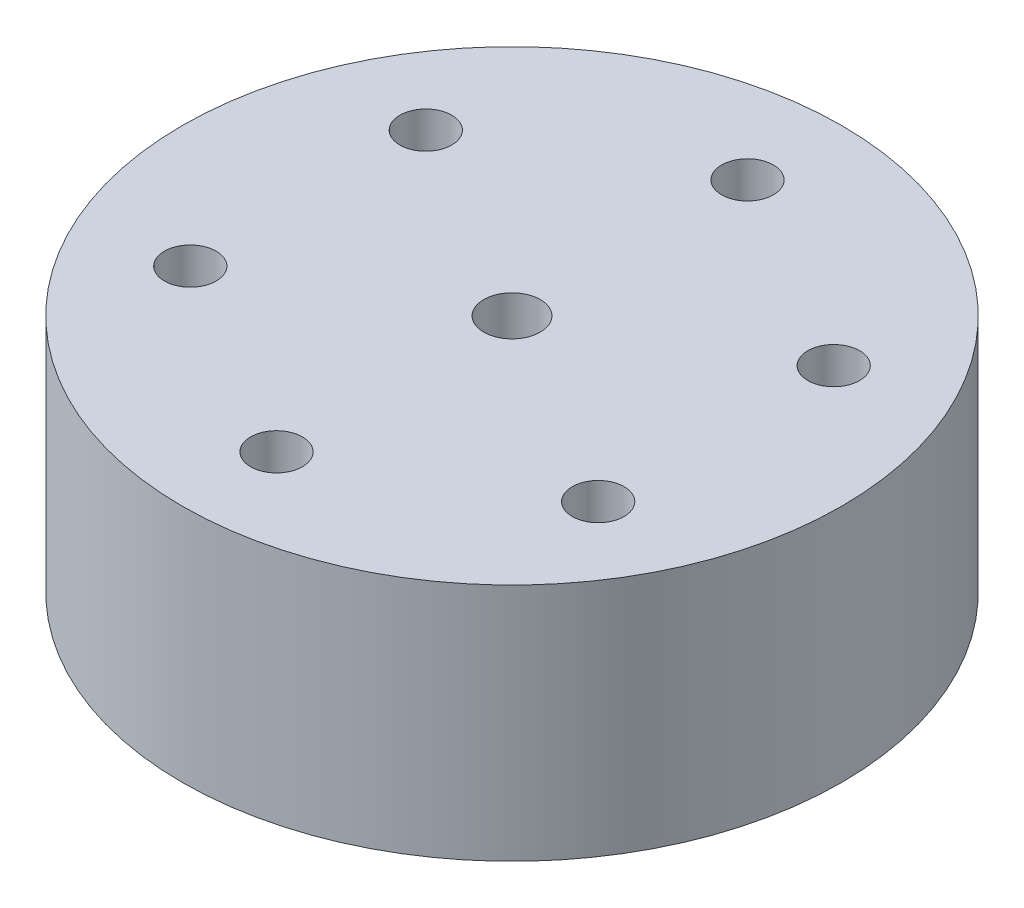
from build123d import *

# Parameters (mm, degrees)
SKETCH2_R           = 35
BOSS_EXTRUDE1_DEPTH = 25.4
CUT_EXTRUDE1_DEPTH  = 56.634162167
SKETCH5_R           = 2.75
CUT_EXTRUDE3_DEPTH  = 56.634162167


with BuildPart() as part:
    # Sketch2 → Boss-Extrude1 (new body)
    with BuildSketch(Plane(origin=(0, 0, 0), x_dir=(1, 0, 0), z_dir=(0, 1, 0))):
        with Locations(Location((0, 0, 0), (0, 0, 270))):
            Circle(SKETCH2_R)
    extrude(amount=BOSS_EXTRUDE1_DEPTH)

    # Sketch3 → Cut-Extrude1 (cut, through all)
    with BuildSketch(Plane(origin=(0, 25.4, 0), x_dir=(1, 0, 0), z_dir=(0, 1, 0))):
        with BuildLine():
            ThreePointArc((-1.658312395, 2.5), (0, -3), (1.658312395, 2.5))
            ThreePointArc((1.658312395, 2.5), (0, 3), (-1.658312395, 2.5))
        make_face()
    extrude(amount=-CUT_EXTRUDE1_DEPTH, mode=Mode.SUBTRACT)

    # Sketch5 → Cut-Extrude3 (cut, through all)
    with BuildSketch(Plane(origin=(0, 25.4, 0), x_dir=(1, 0, 0), z_dir=(0, 1, 0))):
        with Locations(Location((0, 25, 0), (0, 0, 270))):
            Circle(SKETCH5_R)
        with Locations(Location((21.650635095, 12.5, 0), (0, 0, 270))):
            Circle(SKETCH5_R)
        with Locations(Location((21.650635095, -12.5, 0), (0, 0, 270))):
            Circle(SKETCH5_R)
        with Locations(Location((0, -25, 0), (0, 0, 270))):
            Circle(SKETCH5_R)
        with Locations(Location((-21.650635095, -12.5, 0), (0, 0, 270))):
            Circle(SKETCH5_R)
        with Locations(Location((-21.650635095, 12.5, 0), (0, 0, 270))):
            Circle(SKETCH5_R)
    extrude(amount=-CUT_EXTRUDE3_DEPTH, mode=Mode.SUBTRACT)


solid = part.part
